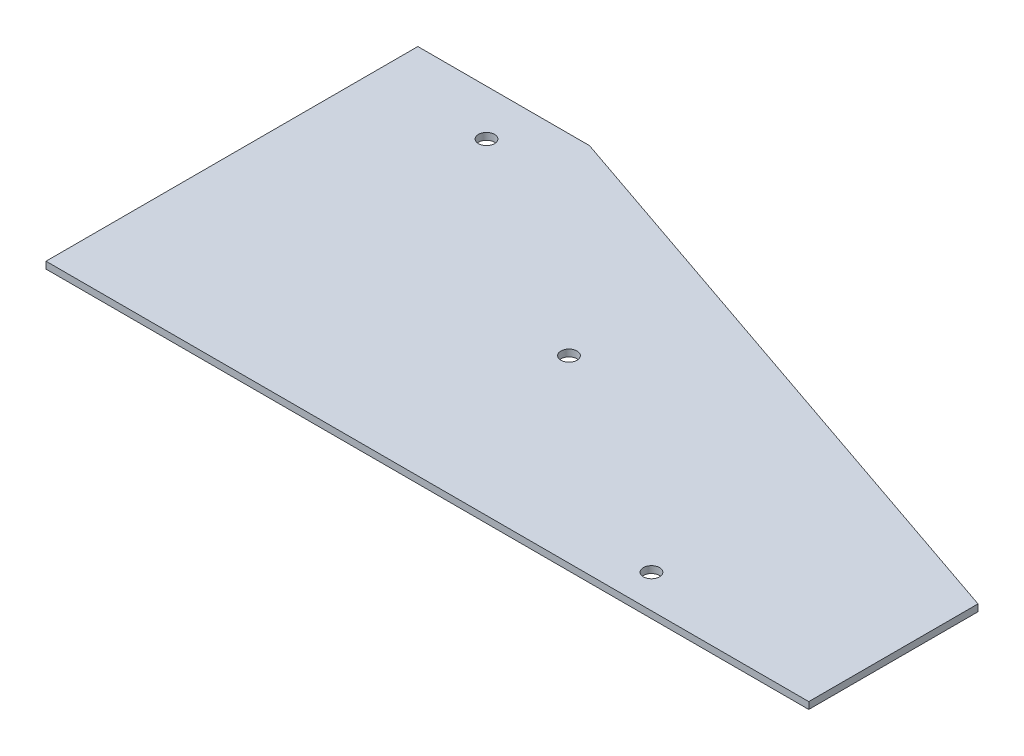
from build123d import *

# Parameters (mm, degrees)
BOSS_EXTRUDE1_DEPTH       = 18.25625
F_1_1_69_DIAMETER_HOLE1_D = 42.926


with BuildPart() as part:
    # Sketch1 → Boss-Extrude1 (new body)
    with BuildSketch(Plane(origin=(0, 0, 0), x_dir=(1, 0, 0), z_dir=(0, 1, 0))):
        Polygon((2032, 450.85), (457.2, 990.6), (0, 990.6), (0, 0), (2032, 0), align=None)
    extrude(amount=BOSS_EXTRUDE1_DEPTH)

    # 1 (1.69) Diameter Hole1 (through all)
    with Locations(Plane(origin=(0, 18.25625, 0), x_dir=(1, 0, 0), z_dir=(0, 1, 0))):
        with Locations((1524, 88.9), (914.4, 478.79), (304.8, 868.68)):
            Hole(F_1_1_69_DIAMETER_HOLE1_D / 2)


solid = part.part
